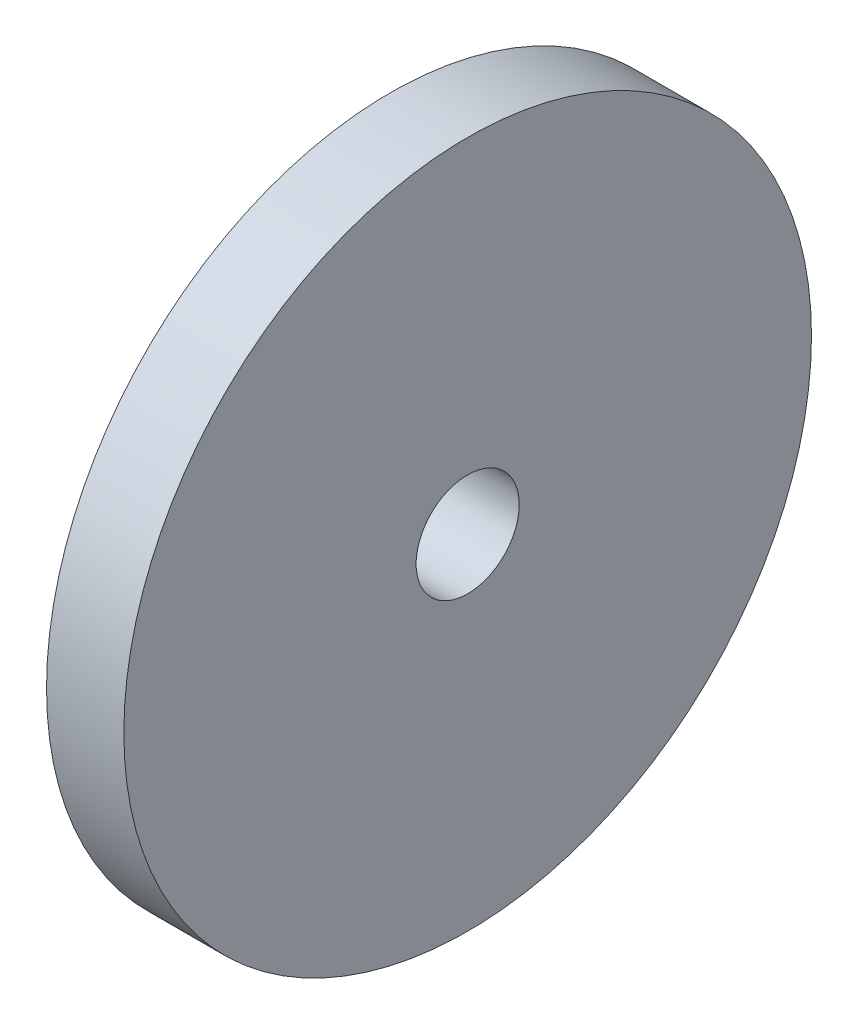
from build123d import *

# Parameters (mm, degrees)
SKETCH1_R           = 33.35
SKETCH1_R_2         = 5
BOSS_EXTRUDE1_DEPTH = 7.5


with BuildPart() as part:
    # Sketch1 → Boss-Extrude1 (new body)
    with BuildSketch(Plane(origin=(0, 0, 0), x_dir=(0, 0, -1), z_dir=(1, 0, 0))):
        Circle(SKETCH1_R)
        Circle(SKETCH1_R_2, mode=Mode.SUBTRACT)
    extrude(amount=BOSS_EXTRUDE1_DEPTH)


solid = part.part
